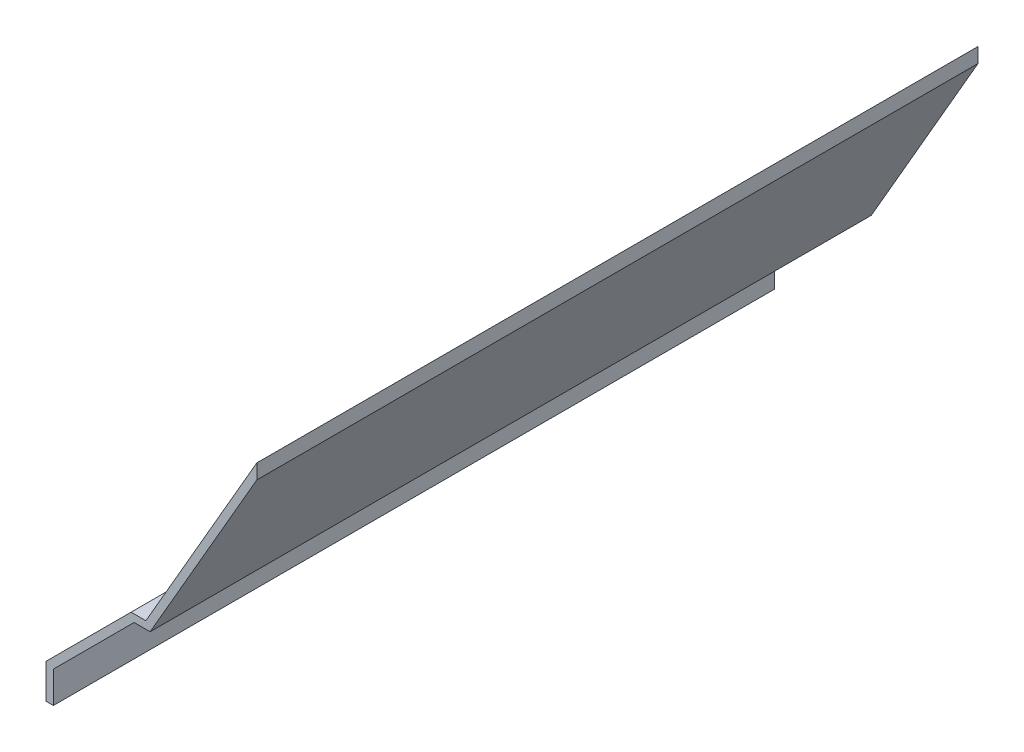
from build123d import *

# Parameters (mm, degrees)
BOSS_EXTRUDE1_DEPTH = 195


with BuildPart() as part:
    # Sketch1 → Boss-Extrude1 (new body)
    with BuildSketch(Plane.XY):
        Polygon((-49.888143666, 168.420715043), (-49.888143666, 164.420715043), (-78.733443127, 114.459190816), (-83.059716541, 114.459190816), (-104.888143666, 92.630763691), (-104.888143666, 84.103851756), (-106.888143666, 84.103851756), (-106.888143666, 93.459190816), (-83.888143666, 116.459190816), (-79.888143666, 116.459190816), align=None)
    extrude(amount=BOSS_EXTRUDE1_DEPTH)


solid = part.part
